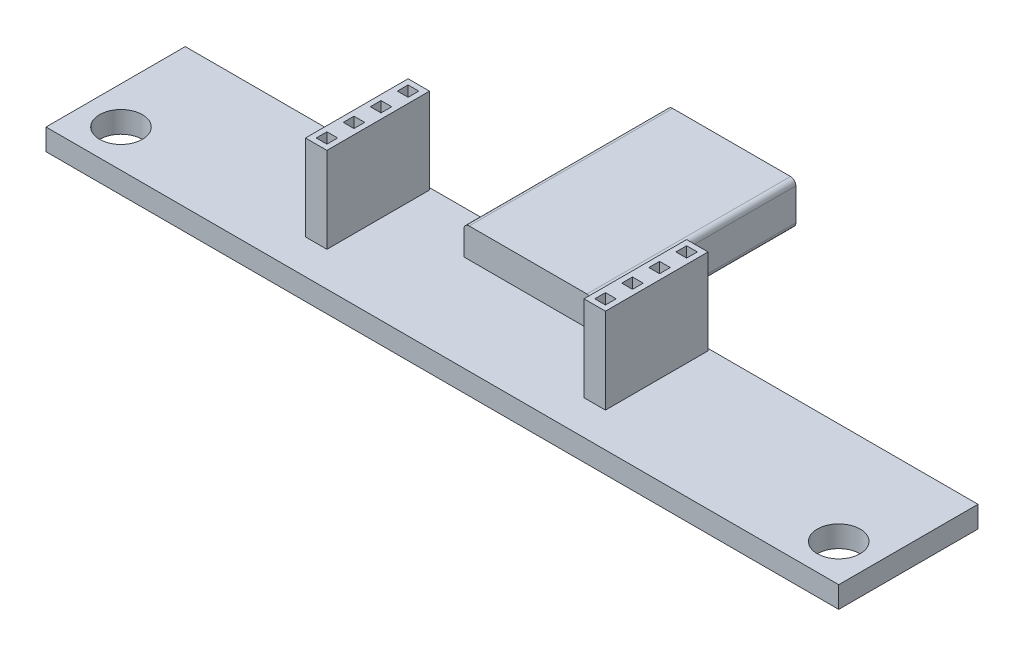
from build123d import *

# Parameters (mm, degrees)
SKETCH1_W           = 74
SKETCH1_H           = 13
SKETCH1_R           = 2
BOSS_EXTRUDE1_DEPTH = 2
SKETCH2_W           = 2
SKETCH2_H           = 9.5775
SKETCH2_W_2         = 1
SKETCH2_H_2         = 1
BOSS_EXTRUDE2_DEPTH = 8
SKETCH3_W           = 12
SKETCH3_H           = 19
BOSS_EXTRUDE3_DEPTH = 4
FILLET1_R           = 0.5


with BuildPart() as part:
    # Sketch1 → Boss-Extrude1 (new body)
    with BuildSketch(Plane(origin=(0, 0, 0), x_dir=(1, 0, 0), z_dir=(0, 1, 0))):
        Rectangle(SKETCH1_W, SKETCH1_H)
        with Locations(Location((-33.5, -3, 0), (0, 0, 270))):
            Circle(SKETCH1_R, mode=Mode.SUBTRACT)
        with Locations(Location((33.5, -3, 0), (0, 0, 90))):
            Circle(SKETCH1_R, mode=Mode.SUBTRACT)
    extrude(amount=BOSS_EXTRUDE1_DEPTH)

    # Sketch2 → Boss-Extrude2 (add)
    # profile 1 of 2: a face of its own
    with BuildSketch(Plane(origin=(0, 2, 0), x_dir=(1, 0, 0), z_dir=(0, 1, 0))):
        with Locations((11, 1.51125)):
            Rectangle(SKETCH2_W, SKETCH2_H)
        with Locations((11, 2.774166667)):
            Rectangle(SKETCH2_W_2, SKETCH2_H_2, mode=Mode.SUBTRACT)
        with Locations((11, 5.3)):
            Rectangle(SKETCH2_W_2, SKETCH2_H_2, mode=Mode.SUBTRACT)
        with Locations((11, 0.248333333)):
            Rectangle(SKETCH2_W_2, SKETCH2_H_2, mode=Mode.SUBTRACT)
        with Locations((11, -2.2775)):
            Rectangle(SKETCH2_W_2, SKETCH2_H_2, mode=Mode.SUBTRACT)
    # profile 2 of 2: a face of its own
    with BuildSketch(Plane(origin=(0, 2, 0), x_dir=(1, 0, 0), z_dir=(0, 1, 0))):
        with Locations((-15, 1.51125)):
            Rectangle(SKETCH2_W, SKETCH2_H)
        with Locations((-15, -2.2775)):
            Rectangle(SKETCH2_W_2, SKETCH2_H_2, mode=Mode.SUBTRACT)
        with Locations((-15, 0.248333333)):
            Rectangle(SKETCH2_W_2, SKETCH2_H_2, mode=Mode.SUBTRACT)
        with Locations((-15, 2.774166667)):
            Rectangle(SKETCH2_W_2, SKETCH2_H_2, mode=Mode.SUBTRACT)
        with Locations((-15, 5.3)):
            Rectangle(SKETCH2_W_2, SKETCH2_H_2, mode=Mode.SUBTRACT)
    extrude(amount=BOSS_EXTRUDE2_DEPTH)

    # Sketch3 → Boss-Extrude3 (add)
    with BuildSketch(Plane(origin=(0, 0.75, 0), x_dir=(1, 0, 0), z_dir=(0, 1, 0))):
        with Locations((-1, 12)):
            Rectangle(SKETCH3_W, SKETCH3_H)
    extrude(amount=BOSS_EXTRUDE3_DEPTH)

    # Fillet1
    fillet1_edges = [part.edges().sort_by_distance(p)[0] for p in [
        (5, 0.75, -14),
        (-7, 0.75, -14),
        (5, 4.75, -12),
        (-7, 4.75, -12),
    ]]
    fillet(fillet1_edges, radius=FILLET1_R)


solid = part.part
